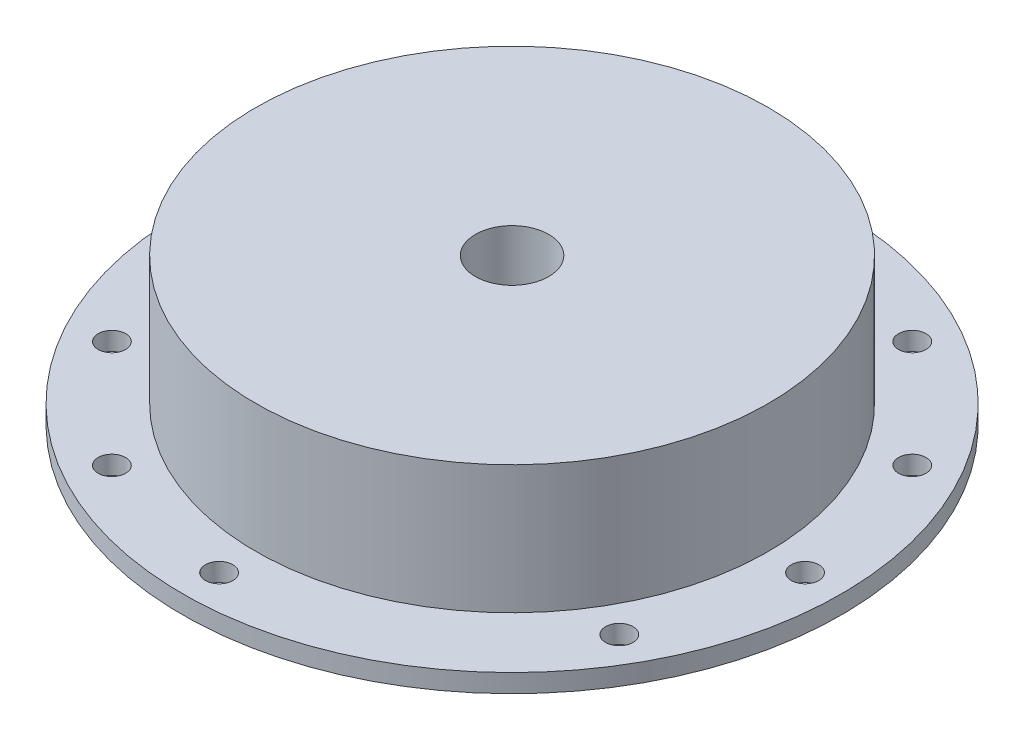
from build123d import *

# Parameters (mm, degrees)
F_3_8_0_375_DIAMETER_HOLE2_D = 9.525
CIRPATTERN2_COUNT            = 12


with BuildPart() as part:
    # Sketch1 → Revolve1 (revolve)
    with BuildSketch(Plane.XY, mode=Mode.PRIVATE) as revolve1_sk:
        with BuildLine():
            Line((12.7, 50.8), (12.7, 25.4))
            ThreePointArc((12.7, 25.4), (35.101936686, 6.703873372), (63.5, 0))
            Line((63.5, 0), (114.3, 0))
            Line((114.3, 0), (114.3, 6.35))
            Line((114.3, 6.35), (88.9, 6.35))
            Line((88.9, 6.35), (88.9, 50.8))
            Line((88.9, 50.8), (12.7, 50.8))
        make_face()
    revolve(revolve1_sk.sketch.rotate(Axis((0, 0, 0), (0, 1, 0)), 90), axis=Axis((0, 0, 0), (0, 1, 0)))

    # 3/8 (0.375) Diameter Hole2 (through all)
    with Locations(Plane(origin=(0, 6.35, 0), x_dir=(1, 0, 0), z_dir=(0, 1, 0))):
        with Locations((0, -101.6)):
            f_3_8_0_375_diameter_hole2 = Hole(F_3_8_0_375_DIAMETER_HOLE2_D / 2)

    # CirPattern2: 3/8 (0.375) Diameter Hole2 ×12 about axis, 1 skipped
    cirpattern2_axis = Axis((0, 0, 0), (0, 1, 0))
    add([f_3_8_0_375_diameter_hole2.rotate(cirpattern2_axis, i * 360 / CIRPATTERN2_COUNT) for i in range(1, CIRPATTERN2_COUNT) if i not in (1,)], mode=Mode.SUBTRACT)


solid = part.part
